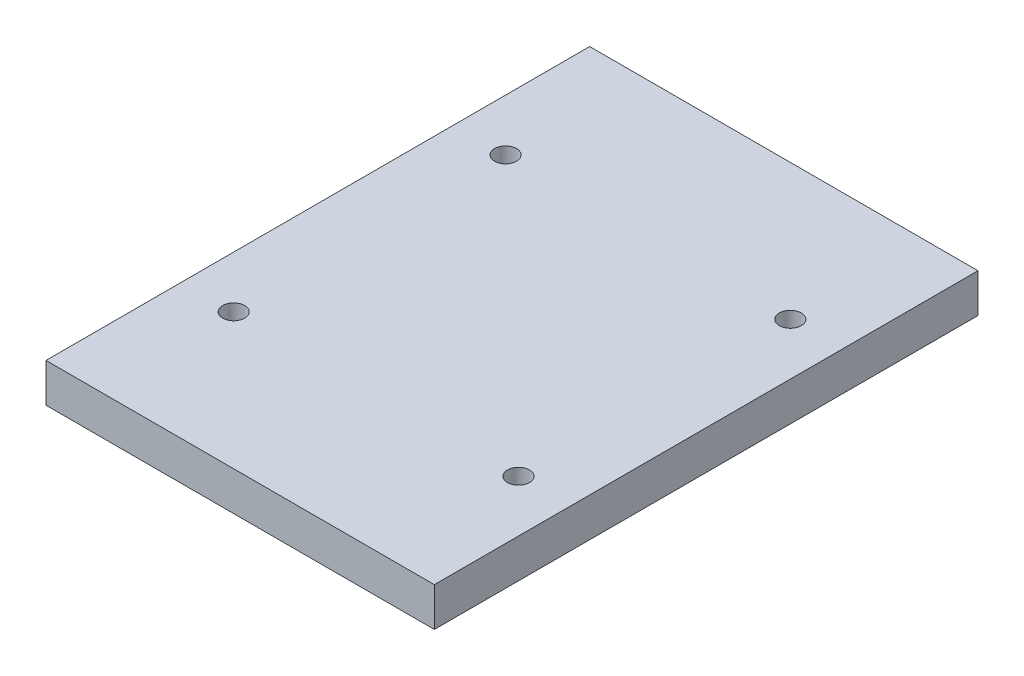
from build123d import *

# Parameters (mm, degrees)
SKETCH1_W           = 60
SKETCH1_H           = 84
RAIL_PLATE_DEPTH    = 6
DOVETAIL_RAIL_DEPTH = 72
SKETCH3_R           = 1.7
M3_HOLES_DEPTH      = 7
SKETCH4_R           = 3
COUNTERBORES_DEPTH  = 4
SKETCH5_R           = 2.25
LOCK_DETENTS_DEPTH  = 2.5


with BuildPart() as part:
    # Sketch1 → Rail Plate (new body)
    with BuildSketch(Plane(origin=(0, -34.4, 0), x_dir=(1, 0, 0), z_dir=(0, 1, 0))):
        with Locations((0, -70)):
            Rectangle(SKETCH1_W, SKETCH1_H)
    extrude(amount=RAIL_PLATE_DEPTH)

    # Sketch2 → Dovetail Rail (add)
    with BuildSketch(Plane.XY.offset(34)):
        Polygon((-14.666666667, -33.9), (14.666666667, -33.9), (19, -40.4), (-19, -40.4), align=None)
    extrude(amount=DOVETAIL_RAIL_DEPTH)

    # Sketch3 → M3 Holes (cut)
    with BuildSketch(Plane(origin=(0, -34.9, 0), x_dir=(1, 0, 0), z_dir=(0, 1, 0))):
        with Locations(Location((-22, -91, 0), (0, 0, 270))):
            Circle(SKETCH3_R)
        with Locations(Location((-22, -49, 0), (0, 0, 270))):
            Circle(SKETCH3_R)
        with Locations(Location((22, -91, 0), (0, 0, 270))):
            Circle(SKETCH3_R)
        with Locations(Location((22, -49, 0), (0, 0, 270))):
            Circle(SKETCH3_R)
    extrude(amount=M3_HOLES_DEPTH, mode=Mode.SUBTRACT)

    # Sketch4 → Counterbores (cut)
    with BuildSketch(Plane(origin=(0, -34.9, 0), x_dir=(1, 0, 0), z_dir=(0, 1, 0))):
        with Locations(Location((-22, -91, 0), (0, 0, 270))):
            Circle(SKETCH4_R)
        with Locations(Location((-22, -49, 0), (0, 0, 270))):
            Circle(SKETCH4_R)
        with Locations(Location((22, -91, 0), (0, 0, 270))):
            Circle(SKETCH4_R)
        with Locations(Location((22, -49, 0), (0, 0, 270))):
            Circle(SKETCH4_R)
    extrude(amount=COUNTERBORES_DEPTH, mode=Mode.SUBTRACT)

    # Sketch5 → Lock Detents (cut)
    with BuildSketch(Plane(origin=(0, -40.9, 0), x_dir=(1, 0, 0), z_dir=(0, 1, 0))):
        with Locations(Location((0, -98, 0), (0, 0, 270))):
            Circle(SKETCH5_R)
        with Locations(Location((0, -42, 0), (0, 0, 270))):
            Circle(SKETCH5_R)
    extrude(amount=LOCK_DETENTS_DEPTH, mode=Mode.SUBTRACT)


solid = part.part
